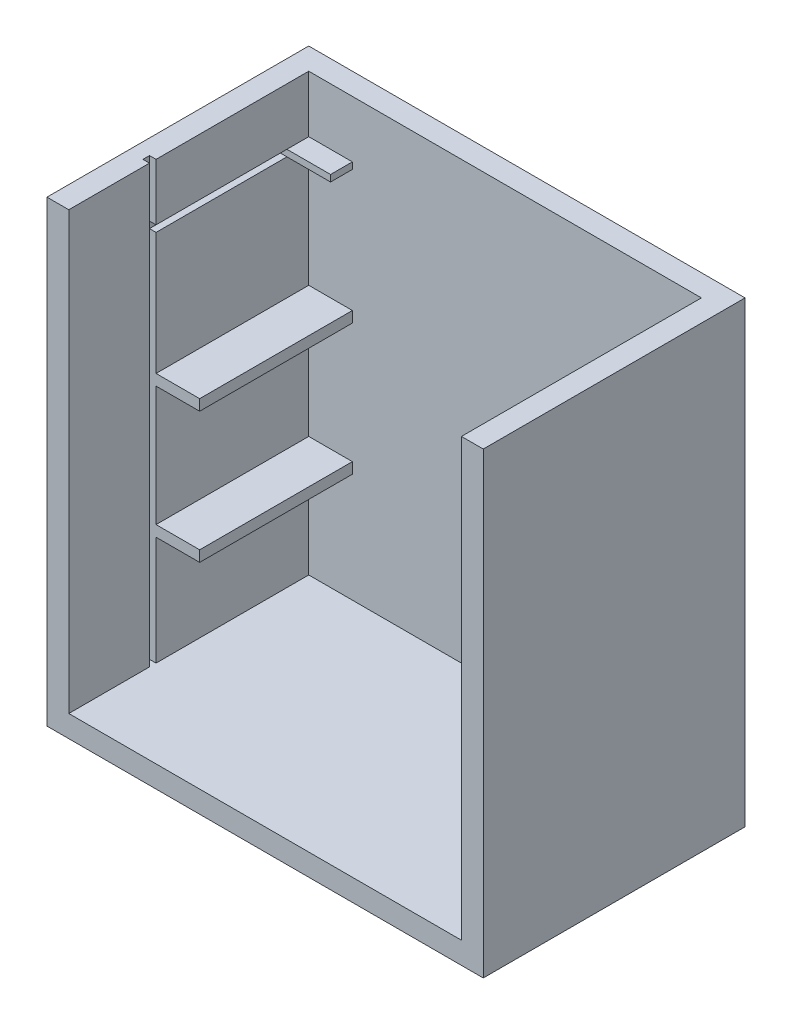
from build123d import *

# Parameters (mm, degrees)
SKETCH1_W           = 200
SKETCH1_H           = 120
BOSS_EXTRUDE2_DEPTH = 10
SKETCH2_W           = 10
SKETCH2_H           = 110
BOSS_EXTRUDE3_DEPTH = 200
SKETCH3_W           = 70
SKETCH3_H           = 5
BOSS_EXTRUDE4_DEPTH = 20
SKETCH4_W           = 70
SKETCH4_H           = 5
BOSS_EXTRUDE5_DEPTH = 20
SKETCH6_W           = 20
SKETCH6_H           = 3
CUT_EXTRUDE1_DEPTH  = 80
CUT_EXTRUDE2_DEPTH  = 3
SKETCH9_W           = 80
SKETCH9_H           = 3
CUT_EXTRUDE5_DEPTH  = 3
SKETCH10_W          = 20
SKETCH10_H          = 1
CUT_EXTRUDE6_DEPTH  = 70
SKETCH11_W          = 23
SKETCH11_H          = 3
BOSS_EXTRUDE6_DEPTH = 20


with BuildPart() as part:
    # Sketch1 → Boss-Extrude2 (new body)
    with BuildSketch(Plane(origin=(0, 0, 0), x_dir=(1, 0, 0), z_dir=(0, 1, 0))):
        with Locations((100, 60)):
            Rectangle(SKETCH1_W, SKETCH1_H)
    extrude(amount=BOSS_EXTRUDE2_DEPTH)

    # Sketch2 → Boss-Extrude3 (add)
    with BuildSketch(Plane(origin=(0, 10, 0), x_dir=(1, 0, 0), z_dir=(0, 1, 0))):
        with Locations((5, 55)):
            Rectangle(SKETCH2_W, SKETCH2_H)
        Polygon((200, 120), (0, 120), (0, 110), (10, 110), (190, 110), (200, 110), align=None)
        with Locations((195, 55)):
            Rectangle(SKETCH2_W, SKETCH2_H)
    extrude(amount=BOSS_EXTRUDE3_DEPTH)

    # Sketch3 → Boss-Extrude4 (add)
    with BuildSketch(Plane(origin=(10, 0, 0), x_dir=(0, 0, -1), z_dir=(1, 0, 0))):
        with Locations((75, 182.5)):
            Rectangle(SKETCH3_W, SKETCH3_H)
        with Locations((75, 122.5)):
            Rectangle(SKETCH3_W, SKETCH3_H)
        with Locations((75, 62.5)):
            Rectangle(SKETCH3_W, SKETCH3_H)
    extrude(amount=BOSS_EXTRUDE4_DEPTH)

    # Sketch4 → Boss-Extrude5 (add)
    with BuildSketch(Plane.ZY.offset(-190)):
        with Locations((-75, 182.5)):
            Rectangle(SKETCH4_W, SKETCH4_H)
        with Locations((-75, 122.5)):
            Rectangle(SKETCH4_W, SKETCH4_H)
        with Locations((-75, 62.5)):
            Rectangle(SKETCH4_W, SKETCH4_H)
    extrude(amount=BOSS_EXTRUDE5_DEPTH)

    # Sketch6 → Cut-Extrude1 (cut)
    with BuildSketch(Plane.XY.offset(-40)):
        with Locations((20, 182.5)):
            Rectangle(SKETCH6_W, SKETCH6_H)
    extrude(amount=-CUT_EXTRUDE1_DEPTH, mode=Mode.SUBTRACT)

    # Sketch7 → Cut-Extrude2 (cut)
    with BuildSketch(Plane(origin=(10, 0, 0), x_dir=(0, 0, -1), z_dir=(1, 0, 0))):
        Polygon((40, 185), (40, 210), (37, 210), (37, 10), (40, 10), align=None)
    extrude(amount=-CUT_EXTRUDE2_DEPTH, mode=Mode.SUBTRACT)

    # Sketch9 → Cut-Extrude5 (cut)
    with BuildSketch(Plane(origin=(10, 0, 0), x_dir=(0, 0, -1), z_dir=(1, 0, 0))):
        with Locations((80, 182.5)):
            Rectangle(SKETCH9_W, SKETCH9_H)
    extrude(amount=-CUT_EXTRUDE5_DEPTH, mode=Mode.SUBTRACT)

    # Sketch10 → Cut-Extrude6 (cut)
    with BuildSketch(Plane.XY.offset(-40)):
        with Locations((20, 184.5)):
            Rectangle(SKETCH10_W, SKETCH10_H)
        with Locations((20, 180.5)):
            Rectangle(SKETCH10_W, SKETCH10_H)
    extrude(amount=-CUT_EXTRUDE6_DEPTH, mode=Mode.SUBTRACT)

    # Sketch11 → Boss-Extrude6 (add)
    with BuildSketch(Plane(origin=(0, 0, -120), x_dir=(-1, 0, 0), z_dir=(0, 0, -1))):
        with Locations((-18.5, 182.5)):
            Rectangle(SKETCH11_W, SKETCH11_H)
    extrude(amount=-BOSS_EXTRUDE6_DEPTH)


solid = part.part
